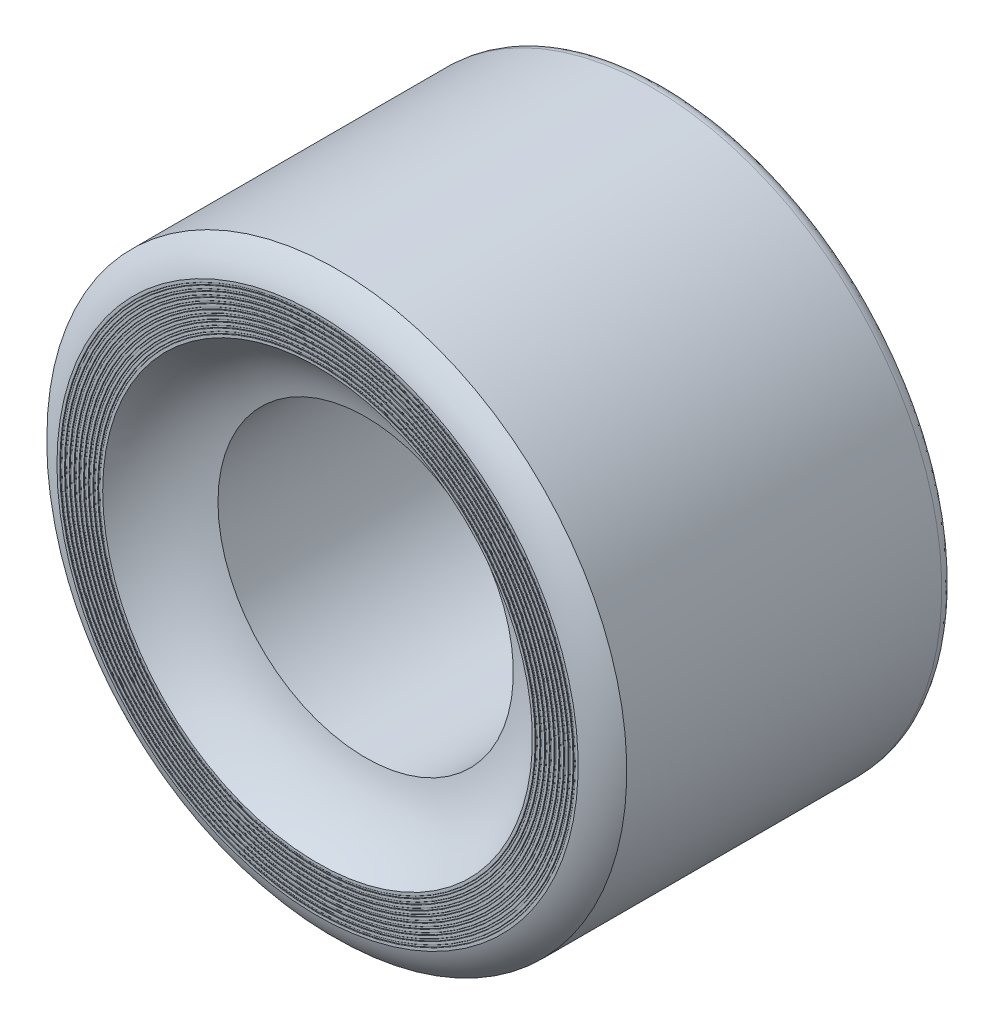
from build123d import *


with BuildPart() as part:
    # Sketch1 → Revolve1 (revolve)
    with BuildSketch(Plane.XZ, mode=Mode.PRIVATE) as revolve1_sk:
        with BuildLine():
            Line((34.97, 26), (34.97, 26.05))
            ThreePointArc((34.97, 26.05), (34.955355339, 26.085355339), (34.92, 26.1))
            Line((34.92, 26.1), (34.57, 26.1))
            ThreePointArc((34.57, 26.1), (34.534644661, 26.085355339), (34.52, 26.05))
            Line((34.52, 26.05), (34.52, 26))
            Line((34.52, 26), (34.27, 26))
            Line((34.27, 26), (34.27, 26.05))
            ThreePointArc((34.27, 26.05), (34.255355339, 26.085355339), (34.22, 26.1))
            Line((34.22, 26.1), (33.87, 26.1))
            ThreePointArc((33.87, 26.1), (33.834644661, 26.085355339), (33.82, 26.05))
            Line((33.82, 26.05), (33.82, 26))
            Line((33.82, 26), (33.57, 26))
            Line((33.57, 26), (33.57, 26.05))
            ThreePointArc((33.57, 26.05), (33.555355339, 26.085355339), (33.52, 26.1))
            Line((33.52, 26.1), (33.17, 26.1))
            ThreePointArc((33.17, 26.1), (33.134644661, 26.085355339), (33.12, 26.05))
            Line((33.12, 26.05), (33.12, 26))
            Line((33.12, 26), (32.87, 26))
            Line((32.87, 26), (32.87, 26.05))
            ThreePointArc((32.87, 26.05), (32.855355339, 26.085355339), (32.82, 26.1))
            Line((32.82, 26.1), (32.47, 26.1))
            ThreePointArc((32.47, 26.1), (32.434644661, 26.085355339), (32.42, 26.05))
            Line((32.42, 26.05), (32.42, 26))
            Line((32.42, 26), (32.17, 26))
            Line((32.17, 26), (32.17, 26.05))
            ThreePointArc((32.17, 26.05), (32.155355339, 26.085355339), (32.12, 26.1))
            Line((32.12, 26.1), (31.72, 26.1))
            add(Edge.make_bspline(
                [(21.8, 19), (26.031900277, 20.03239032), (29.338566943, 22.399056986), (31.72, 26.1)],
                knots=[0, 0, 0, 0, 1, 1, 1, 1], degree=3))
            Line((21.8, 19), (21.8, -19))
            add(Edge.make_bspline(
                [(42.8, -23.25), (42.8, -25.651646292), (39.567005868, -25.29703954), (35.635134042, -25.952076132), (33.42405472, -26.636262053), (28.300327112, -23.089167505), (26.086169297, -18.030874988), (21.8, -19)],
                knots=[0, 0, 0, 0, 0.25, 0.25, 0.5, 0.5, 1, 1, 1, 1], degree=3))
            Line((42.8, -23.25), (42.8, 23.25))
            ThreePointArc((42.8, 23.25), (40.827876695, 24.968037224), (38.47, 26.1))
            Line((38.47, 26.1), (38.07, 26.1))
            ThreePointArc((38.07, 26.1), (38.034644661, 26.085355339), (38.02, 26.05))
            Line((38.02, 26.05), (38.02, 26))
            Line((38.02, 26), (37.77, 26))
            Line((37.77, 26), (37.77, 26.05))
            ThreePointArc((37.77, 26.05), (37.755355339, 26.085355339), (37.72, 26.1))
            Line((37.72, 26.1), (37.37, 26.1))
            ThreePointArc((37.37, 26.1), (37.334644661, 26.085355339), (37.32, 26.05))
            Line((37.32, 26.05), (37.32, 26))
            Line((37.32, 26), (37.07, 26))
            Line((37.07, 26), (37.07, 26.05))
            ThreePointArc((37.07, 26.05), (37.055355339, 26.085355339), (37.02, 26.1))
            Line((37.02, 26.1), (36.67, 26.1))
            ThreePointArc((36.67, 26.1), (36.634644661, 26.085355339), (36.62, 26.05))
            Line((36.62, 26.05), (36.62, 26))
            Line((36.62, 26), (36.37, 26))
            Line((36.37, 26), (36.37, 26.05))
            ThreePointArc((36.37, 26.05), (36.355355339, 26.085355339), (36.32, 26.1))
            Line((36.32, 26.1), (35.97, 26.1))
            ThreePointArc((35.97, 26.1), (35.934644661, 26.085355339), (35.92, 26.05))
            Line((35.92, 26.05), (35.92, 26))
            Line((35.92, 26), (35.67, 26))
            Line((35.67, 26), (35.67, 26.05))
            ThreePointArc((35.67, 26.05), (35.655355339, 26.085355339), (35.62, 26.1))
            Line((35.62, 26.1), (35.27, 26.1))
            ThreePointArc((35.27, 26.1), (35.234644661, 26.085355339), (35.22, 26.05))
            Line((35.22, 26.05), (35.22, 26))
            Line((35.22, 26), (34.97, 26))
        make_face()
    revolve(revolve1_sk.sketch.rotate(Axis((0, 0, 26.259071706), (0, 0, -1)), 180), axis=Axis((0, 0, 26.259071706), (0, 0, -1)))


solid = part.part
